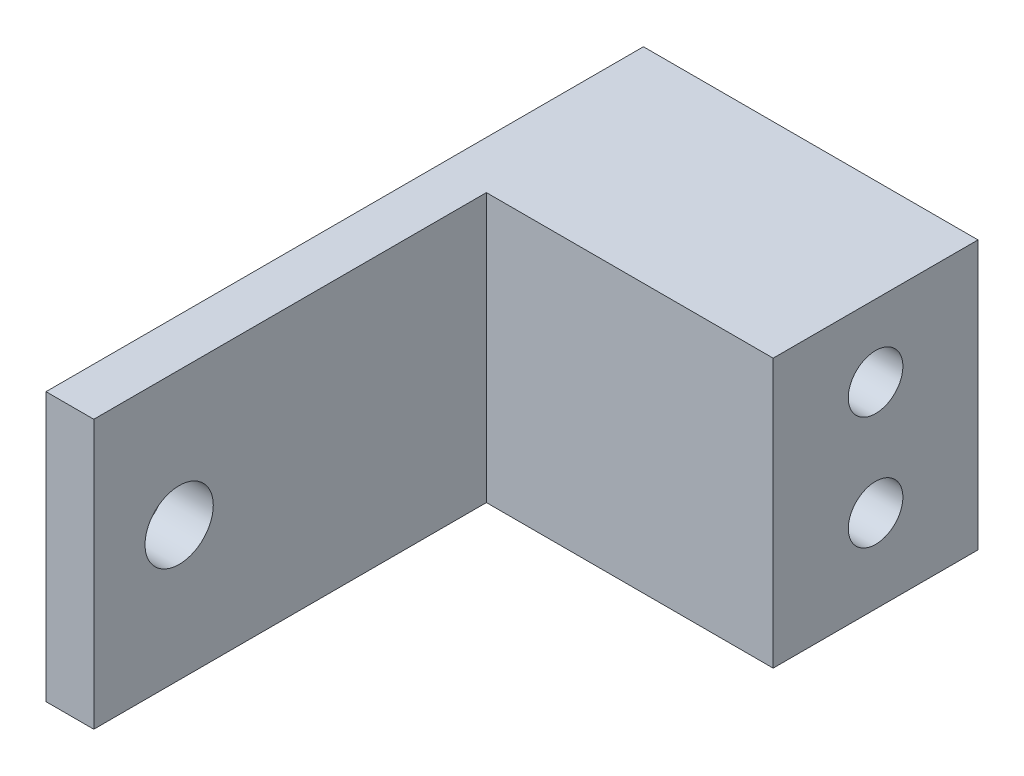
from build123d import *

# Parameters (mm, degrees)
CROQUIS1_W                = 6
CROQUIS1_H                = 7.864261992
SALIENTE_EXTRUIR1_DEPTH   = 9.8
CROQUIS2_W                = 1.4
CROQUIS2_H                = 7.864261992
SALIENTE_EXTRUIR2_DEPTH   = 11.5
CROQUIS3_R                = 1
CORTAR_EXTRUIR1_DEPTH     = 1.4
TALADRO_ROSCADO_M21_D     = 1.6
TALADRO_ROSCADO_M21_DEPTH = 13
TALADRO_ROSCADO_M21_TIP   = 0.480688495


with BuildPart() as part:
    # Croquis1 → Saliente-Extruir1 (new body)
    with BuildSketch(Plane.ZY.offset(-26.697955236)):
        with Locations((-48.344788292, -103.185244075)):
            Rectangle(CROQUIS1_W, CROQUIS1_H)
    extrude(amount=SALIENTE_EXTRUIR1_DEPTH)

    # Croquis2 → Saliente-Extruir2 (add)
    with BuildSketch(Plane.XY.offset(-45.344788292)):
        with Locations((17.597955236, -103.185244075)):
            Rectangle(CROQUIS2_W, CROQUIS2_H)
    extrude(amount=SALIENTE_EXTRUIR2_DEPTH)

    # Croquis3 → Cortar-Extruir1 (cut)
    with BuildSketch(Plane(origin=(18.297955236, 0, 0), x_dir=(0, 0, -1), z_dir=(1, 0, 0))):
        with Locations((36.344788292, -103.185244075)):
            Circle(CROQUIS3_R)
    extrude(amount=-CORTAR_EXTRUIR1_DEPTH, mode=Mode.SUBTRACT)

    # Taladro roscado M21
    with Locations(Plane(origin=(26.697955236, 0, 0), x_dir=(0, 0, -1), z_dir=(1, 0, 0))):
        with Locations((48.344788292, -104.677829932), (48.344788292, -101.359309211)):
            Hole(TALADRO_ROSCADO_M21_D / 2, depth=TALADRO_ROSCADO_M21_DEPTH)
            with Locations((0, 0, -(TALADRO_ROSCADO_M21_DEPTH + TALADRO_ROSCADO_M21_TIP / 2))):  # 118° drill point
                Cone(0, TALADRO_ROSCADO_M21_D / 2, TALADRO_ROSCADO_M21_TIP, mode=Mode.SUBTRACT)


solid = part.part
